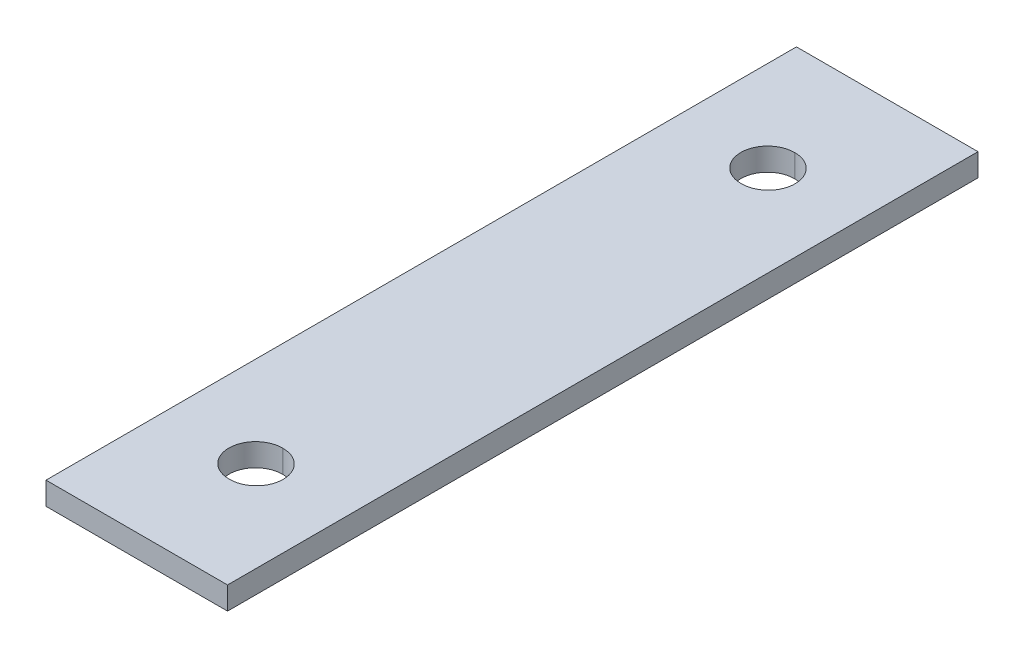
from build123d import *

# Parameters (mm, degrees)
SKETCH1_W           = 25.4
SKETCH1_H           = 105
BOSS_EXTRUDE1_DEPTH = 3.175
CUT_EXTRUDE1_DEPTH  = 55.107491394


with BuildPart() as part:
    # Sketch1 → Boss-Extrude1 (new body)
    with BuildSketch(Plane(origin=(0, 0, 0), x_dir=(1, 0, 0), z_dir=(0, 1, 0))):
        Rectangle(SKETCH1_W, SKETCH1_H)
    extrude(amount=BOSS_EXTRUDE1_DEPTH)

    # Sketch2 → Cut-Extrude1 (cut, through all)
    with BuildSketch(Plane(origin=(0, 3.175, 0), x_dir=(1, 0, 0), z_dir=(0, 1, 0))):
        with BuildLine():
            Line((-0.05, 39.564), (0.05, 39.564))
            ThreePointArc((0.05, 39.564), (3.8, 35.814), (0.05, 32.064))
            Line((0.05, 32.064), (-0.05, 32.064))
            ThreePointArc((-0.05, 32.064), (-3.8, 35.814), (-0.05, 39.564))
        make_face()
        with BuildLine():
            Line((-0.05, -32.064), (0.05, -32.064))
            ThreePointArc((0.05, -32.064), (3.8, -35.814), (0.05, -39.564))
            Line((0.05, -39.564), (-0.05, -39.564))
            ThreePointArc((-0.05, -39.564), (-3.8, -35.814), (-0.05, -32.064))
        make_face()
    extrude(amount=-CUT_EXTRUDE1_DEPTH, mode=Mode.SUBTRACT)


solid = part.part
